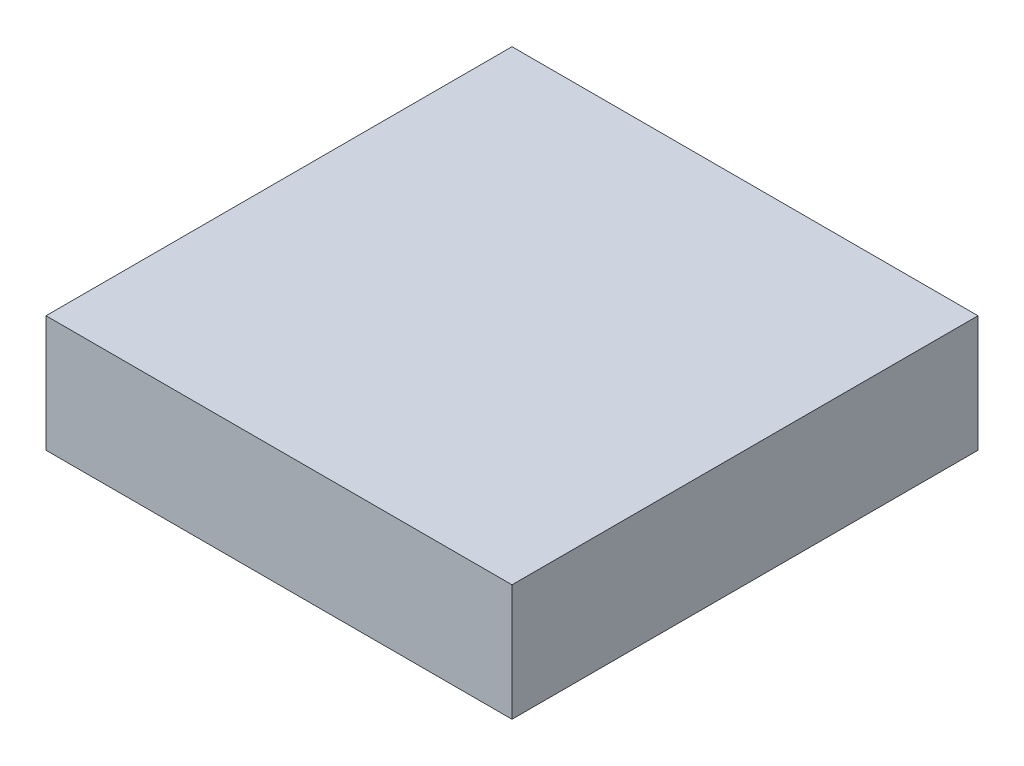
from build123d import *

# Parameters (mm, degrees)
SKETCH1_W           = 2
SKETCH1_H           = 2
BOSS_EXTRUDE1_DEPTH = 0.5


with BuildPart() as part:
    # Sketch1 → Boss-Extrude1 (new body)
    with BuildSketch(Plane(origin=(0, 0, 0), x_dir=(1, 0, 0), z_dir=(0, 1, 0))):
        with Locations((0.113970588, -0.016544118)):
            Rectangle(SKETCH1_W, SKETCH1_H)
    extrude(amount=BOSS_EXTRUDE1_DEPTH)


solid = part.part
